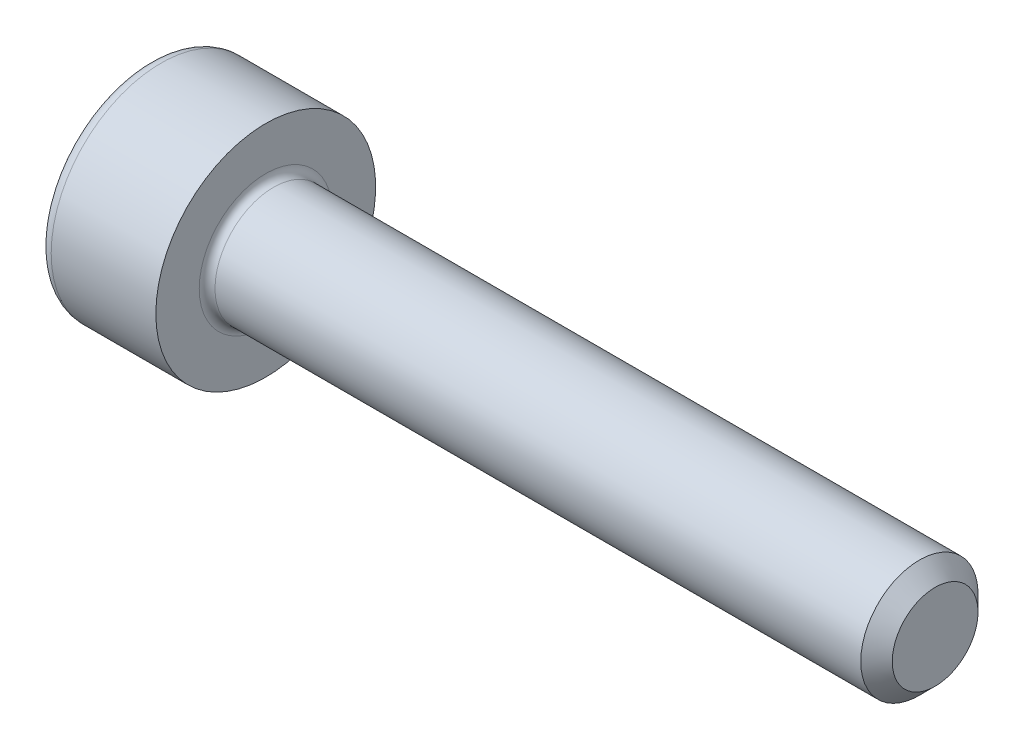
from build123d import *

# Parameters (mm, degrees)
FILLET1_R      = 0.1
FILLET2_R      = 0.16
CHAMFER1_SIZE  = 0.2
EXTRUDE1_DEPTH = 0.7


with BuildPart() as part:
    # Sketch1 → Revolve1 (revolve)
    with BuildSketch(Plane.XY, mode=Mode.PRIVATE) as revolve1_sk:
        Polygon((0, 1.395688245), (0, 0), (9.988734128, 0), (9.988734128, 0.744367064), (1.488734128, 0.744367064), (1.488734128, 1.395688245), align=None)
    revolve(revolve1_sk.sketch.rotate(Axis((0, 0, 0), (1, 0, 0)), 90), axis=Axis((0, 0, 0), (1, 0, 0)))

    # Fillet1
    fillet1_edges = [part.edges().sort_by_distance(p)[0] for p in [
        (1.488734128, 0, -0.744367064),
    ]]
    fillet(fillet1_edges, radius=FILLET1_R)

    # Fillet2
    fillet2_edges = [part.edges().sort_by_distance(p)[0] for p in [
        (0, 0, -1.395688245),
    ]]
    fillet(fillet2_edges, radius=FILLET2_R)

    # Chamfer1
    chamfer1_edges = [part.edges().sort_by_distance(p)[0] for p in [
        (9.988734128, 0, -0.744367064),
    ]]
    chamfer(chamfer1_edges, length=CHAMFER1_SIZE)

    # Sketch2 → Extrude1 (cut)
    with BuildSketch(Plane.ZY):
        Polygon((0, 0.877572409), (-0.76, 0.438786205), (-0.76, -0.438786205), (0, -0.877572409), (0.76, -0.438786205), (0.76, 0.438786205), align=None)
    extrude(amount=-EXTRUDE1_DEPTH, mode=Mode.SUBTRACT)


solid = part.part
